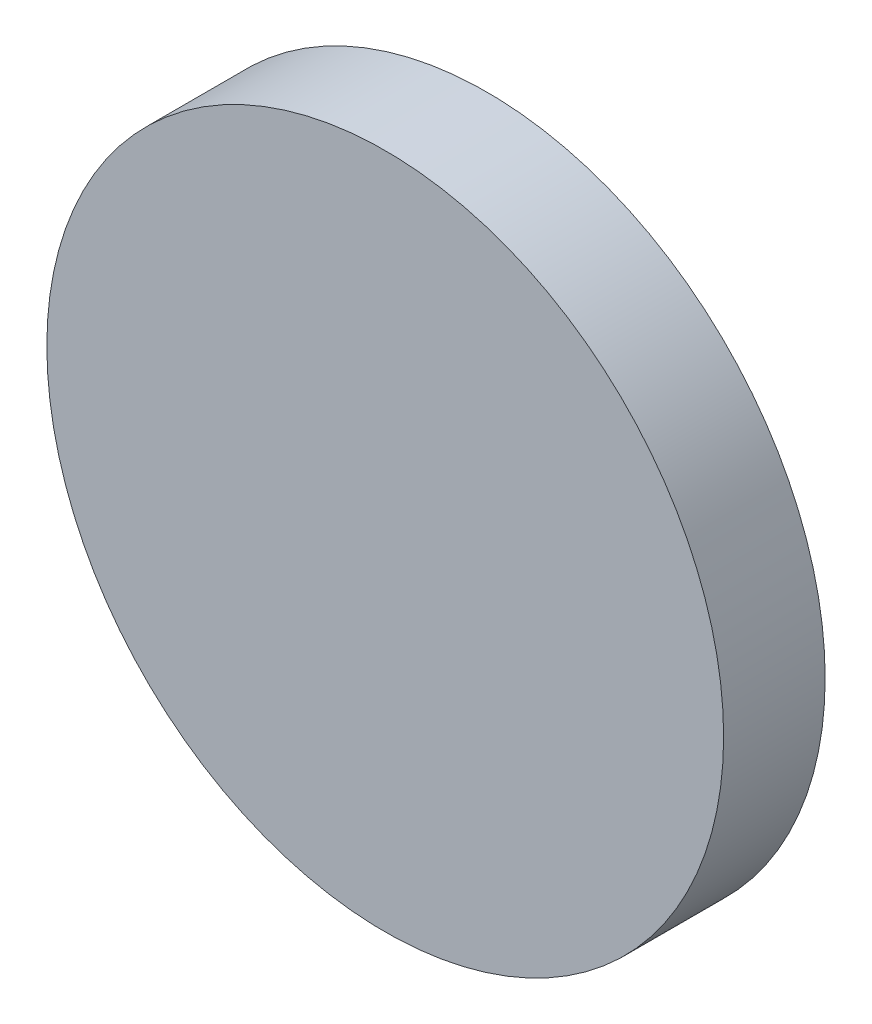
from build123d import *

# Parameters (mm, degrees)
SKETCH_1_R      = 100
EXTRUDE_2_DEPTH = 15


with BuildPart() as part:
    # 草圖1 → 填料-伸長2 (new, symmetric)
    with BuildSketch(Plane.XY):
        Circle(SKETCH_1_R)
    extrude(amount=EXTRUDE_2_DEPTH, both=True)


solid = part.part
